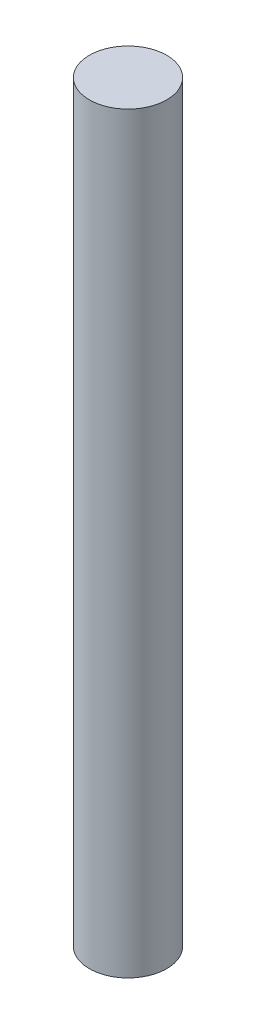
from build123d import *

# Parameters (mm, degrees)
ESBO_O1_R                = 1.5825
RESSALTO_EXTRUS_O1_DEPTH = 30.8


with BuildPart() as part:
    # Esboço1 → Ressalto-extrusão1 (new body)
    with BuildSketch(Plane(origin=(0, 0, 0), x_dir=(1, 0, 0), z_dir=(0, 1, 0))):
        with Locations(Location((0, 0, 0), (0, 0, 90))):
            Circle(ESBO_O1_R)
    extrude(amount=RESSALTO_EXTRUS_O1_DEPTH)


solid = part.part
